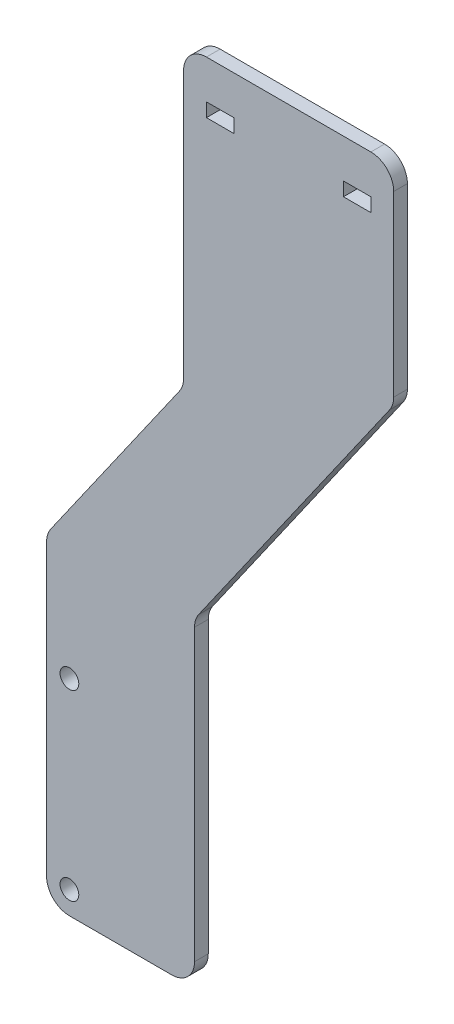
from build123d import *

# Parameters (mm, degrees)
SKETCH1_R           = 2.05
SKETCH1_W           = 6
SKETCH1_H           = 3
BOSS_EXTRUDE1_DEPTH = 3
FILLET1_R           = 5


with BuildPart() as part:
    # Sketch1 → Boss-Extrude1 (new body)
    with BuildSketch(Plane.XY):
        Polygon((-43.603832711, -10.844440202), (-76, -10.844440202), (-76, 59.155559798), (-46, 102), (-46, 167), (0, 167), (0, 121.42828657), (-43.603832711, 59.155559798), (-43.603832711, 39.727273228), align=None)
        with Locations((-71, 34.155559798)):
            Circle(SKETCH1_R, mode=Mode.SUBTRACT)
        with Locations((-71, -5.844440202)):
            Circle(SKETCH1_R, mode=Mode.SUBTRACT)
        with Locations((-38, 157)):
            Rectangle(SKETCH1_W, SKETCH1_H, mode=Mode.SUBTRACT)
        with Locations((-8, 157)):
            Rectangle(SKETCH1_W, SKETCH1_H, mode=Mode.SUBTRACT)
    extrude(amount=BOSS_EXTRUDE1_DEPTH)

    # Fillet1
    fillet1_edges = [part.edges().sort_by_distance(p)[0] for p in [
        (-43.603832711, 59.155559798, 1.5),
        (-43.603832711, -10.844440202, 1.5),
        (-76, -10.844440202, 1.5),
        (-76, 59.155559798, 1.5),
        (-46, 102, 1.5),
        (-46, 167, 1.5),
        (0, 167, 1.5),
        (0, 121.42828657, 1.5),
    ]]
    fillet(fillet1_edges, radius=FILLET1_R)


solid = part.part
